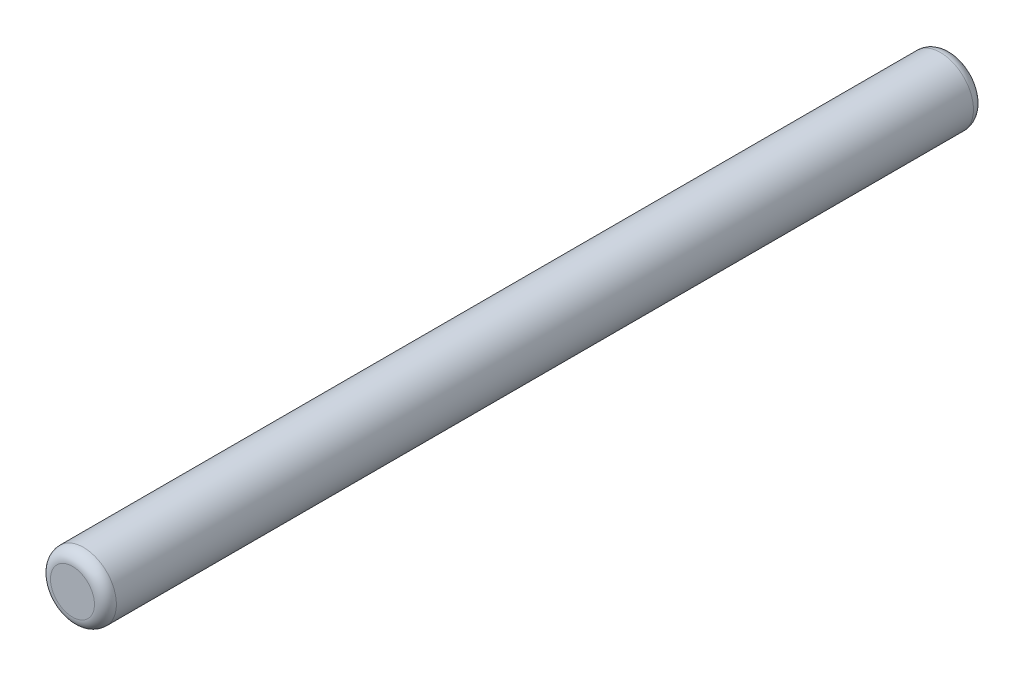
from build123d import *

# Parameters (mm, degrees)
ESQUISSE1_R        = 3
BOSS_EXTRU_1_DEPTH = 80
CONG_1_R           = 1


with BuildPart() as part:
    # Esquisse1 → Boss.-Extru.1 (new body)
    with BuildSketch(Plane.XY):
        Circle(ESQUISSE1_R)
    extrude(amount=BOSS_EXTRU_1_DEPTH)

    # Congé1
    cong_1_edges = [part.edges().sort_by_distance(p)[0] for p in [
        (-3, 0, 0),
        (-3, 0, 80),
    ]]
    fillet(cong_1_edges, radius=CONG_1_R)


solid = part.part
